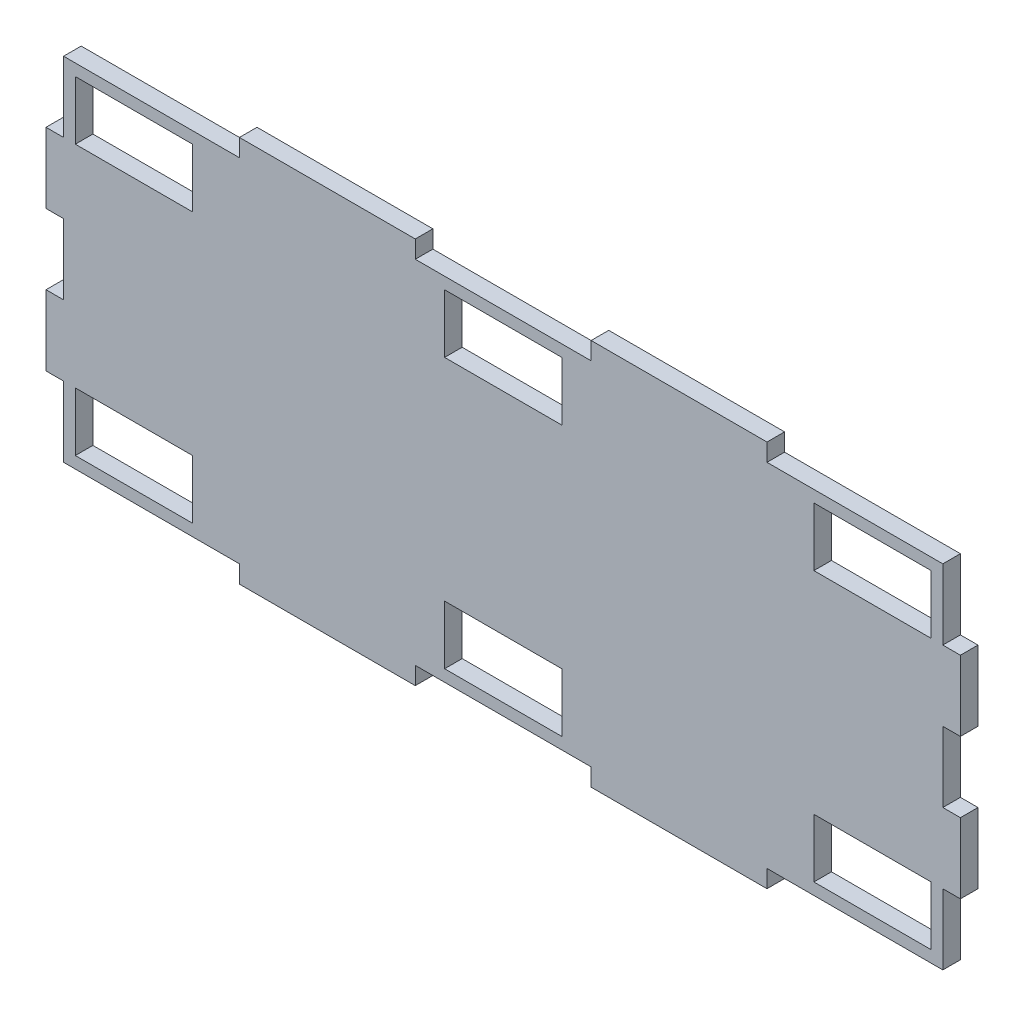
from build123d import *

# Parameters (mm, degrees)
ESBO_O1_W                = 20
ESBO_O1_H                = 10
RESSALTO_EXTRUS_O1_DEPTH = 3


with BuildPart() as part:
    # Esboço1 → Ressalto-extrusão1 (new body)
    with BuildSketch(Plane.XY):
        Polygon((-15, 30), (15, 30), (15, 33), (45, 33), (45, 30), (75, 30), (75, 18), (78, 18), (78, 6), (75, 6), (75, -6), (78, -6), (78, -18), (75, -18), (75, -30), (45, -30), (45, -33), (15, -33), (15, -30), (-15, -30), (-15, -33), (-45, -33), (-45, -30), (-75, -30), (-75, -18), (-78, -18), (-78, -6), (-75, -6), (-75, 6), (-78, 6), (-78, 18), (-75, 18), (-75, 30), (-45, 30), (-45, 33), (-15, 33), align=None)
        with Locations((63, -23)):
            Rectangle(ESBO_O1_W, ESBO_O1_H, mode=Mode.SUBTRACT)
        with Locations((-63, -23)):
            Rectangle(ESBO_O1_W, ESBO_O1_H, mode=Mode.SUBTRACT)
        with Locations((-63, 23)):
            Rectangle(ESBO_O1_W, ESBO_O1_H, mode=Mode.SUBTRACT)
        with Locations((63, 23)):
            Rectangle(ESBO_O1_W, ESBO_O1_H, mode=Mode.SUBTRACT)
        with Locations((0, -23)):
            Rectangle(ESBO_O1_W, ESBO_O1_H, mode=Mode.SUBTRACT)
        with Locations((0, 23)):
            Rectangle(ESBO_O1_W, ESBO_O1_H, mode=Mode.SUBTRACT)
    extrude(amount=RESSALTO_EXTRUS_O1_DEPTH)


solid = part.part
